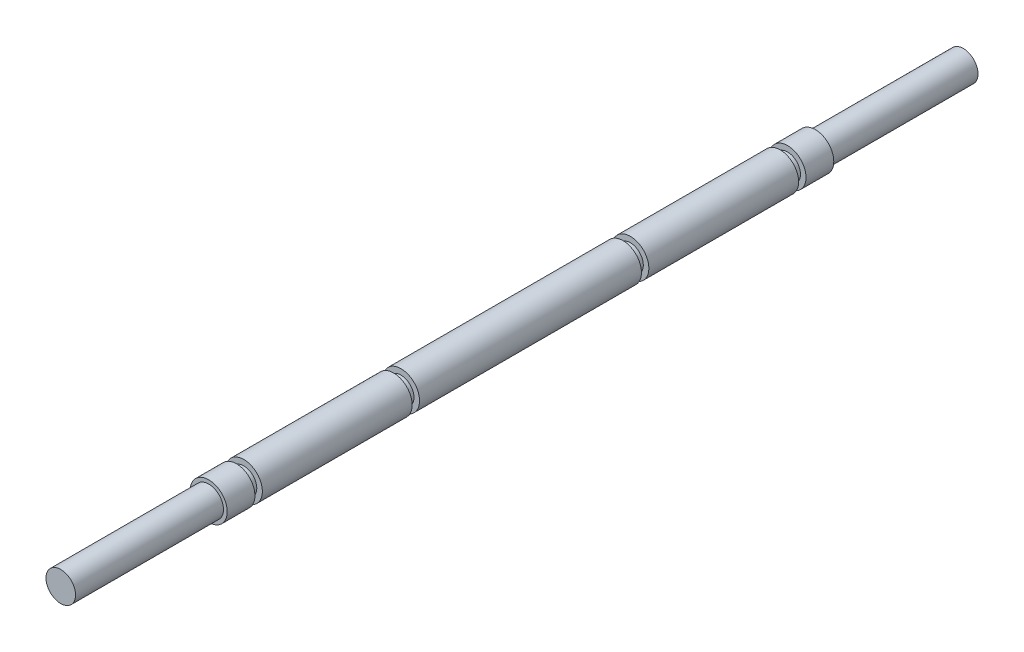
from build123d import *

# Parameters (mm, degrees)
SKETCH_1_R          = 5
EXTRUDE_1_DEPTH     = 60
SKETCH_2_R          = 3.5
EXTRUDE_2_DEPTH     = 2
EXTRUDE_START       = 2
SKETCH_3_R          = 3.5
EXTRUDE_3_DEPTH     = 2
EXTRUDE_START_2     = 90
SKETCH_4_R          = 5
EXTRUDE_4_DEPTH     = 90
SKETCH_5_R          = 5
EXTRUDE_5_DEPTH     = 90
CUT_EXTRUDE_START   = -40
SKETCH_6_R          = 5
SKETCH_6_R_2        = 4
CUT_EXTRUDE_2_DEPTH = 40
SKETCH_7_R          = 5
SKETCH_7_R_2        = 4
CUT_EXTRUDE_3_DEPTH = 40
CUT_EXTRUDE_START_2 = 2
SKETCH_8_R          = 5
SKETCH_8_R_2        = 3.5
CUT_EXTRUDE_4_DEPTH = 2
SKETCH_9_R          = 5
SKETCH_9_R_2        = 3.5
CUT_EXTRUDE_5_DEPTH = 2


with BuildPart() as part:
    # 草图1 → 凸台-拉伸1 (new body)
    with BuildSketch(Plane.XY):
        Circle(SKETCH_1_R)
    extrude(amount=EXTRUDE_1_DEPTH)

    # 草图2 → 凸台-拉伸2 (add)
    with BuildSketch(Plane.XY.offset(60)):
        Circle(SKETCH_2_R)
    extrude(amount=EXTRUDE_2_DEPTH)

    # 草图3 → 凸台-拉伸3 (add)
    with BuildSketch(Plane(origin=(0, 0, 0), x_dir=(-1, 0, 0), z_dir=(0, 0, -1)).offset(EXTRUDE_START)):
        with Locations(Location((0, 0, 0), (0, 0, 180))):
            Circle(SKETCH_3_R)
    extrude(amount=-EXTRUDE_3_DEPTH)

    # 草图4 → 凸台-拉伸4 (add)
    with BuildSketch(Plane(origin=(0, 0, -2), x_dir=(-1, 0, 0), z_dir=(0, 0, -1)).offset(EXTRUDE_START_2)):
        with Locations(Location((0, 0, 0), (0, 0, 180))):
            Circle(SKETCH_4_R)
    extrude(amount=-EXTRUDE_4_DEPTH)

    # 草图5 → 凸台-拉伸5 (add)
    with BuildSketch(Plane.XY.offset(62)):
        Circle(SKETCH_5_R)
    extrude(amount=EXTRUDE_5_DEPTH)

    # 草图6 → 切除-拉伸2 (cut)
    with BuildSketch(Plane.XY.offset(152).offset(CUT_EXTRUDE_START)):
        with Locations(Location((0, 0, 0), (0, 0, 180))):
            Circle(SKETCH_6_R)
        Circle(SKETCH_6_R_2, mode=Mode.SUBTRACT)
    extrude(amount=CUT_EXTRUDE_2_DEPTH, mode=Mode.SUBTRACT)

    # 草图7 → 切除-拉伸3 (cut)
    with BuildSketch(Plane(origin=(0, 0, -92), x_dir=(-1, 0, 0), z_dir=(0, 0, -1))):
        with Locations(Location((0, 0, 0), (0, 0, 180))):
            Circle(SKETCH_7_R)
        with Locations(Location((0, 0, 0), (0, 0, 180))):
            Circle(SKETCH_7_R_2, mode=Mode.SUBTRACT)
    extrude(amount=-CUT_EXTRUDE_3_DEPTH, mode=Mode.SUBTRACT)

    # 草图8 → 切除-拉伸4 (cut)
    with BuildSketch(Plane(origin=(0, 0, -42.5), x_dir=(-1, 0, 0), z_dir=(0, 0, -1)).offset(CUT_EXTRUDE_START_2)):
        with Locations(Location((0, 0, 0), (0, 0, 180))):
            Circle(SKETCH_8_R)
        with Locations(Location((0, 0, 0), (0, 0, 180))):
            Circle(SKETCH_8_R_2, mode=Mode.SUBTRACT)
    extrude(amount=-CUT_EXTRUDE_4_DEPTH, mode=Mode.SUBTRACT)

    # 草图9 → 切除-拉伸5 (cut)
    with BuildSketch(Plane.XY.offset(102.5)):
        with Locations(Location((0, 0, 0), (0, 0, 180))):
            Circle(SKETCH_9_R)
        Circle(SKETCH_9_R_2, mode=Mode.SUBTRACT)
    extrude(amount=CUT_EXTRUDE_5_DEPTH, mode=Mode.SUBTRACT)


solid = part.part
